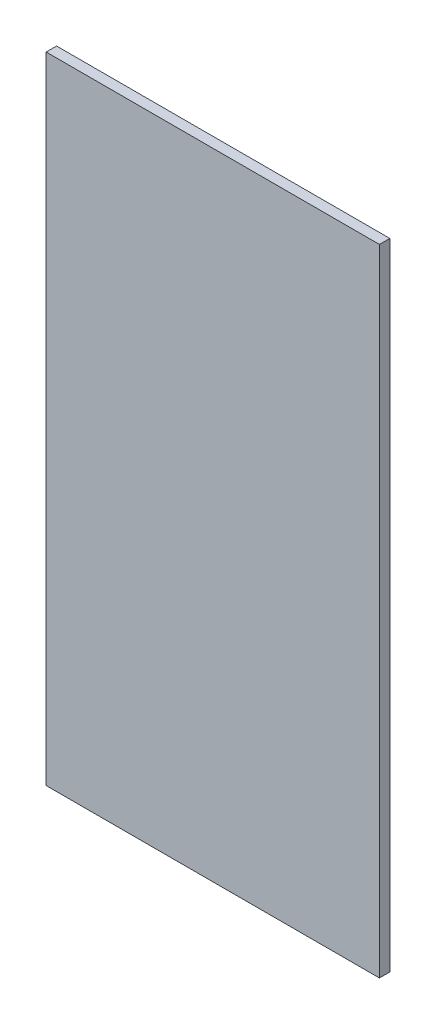
from build123d import *

# Parameters (mm, degrees)
SKETCH1_W           = 203.2
SKETCH1_H           = 387.35
BOSS_EXTRUDE1_DEPTH = 6.35


with BuildPart() as part:
    # Sketch1 → Boss-Extrude1 (new body)
    with BuildSketch(Plane.XY):
        with Locations((38.447665056, 88.148429952)):
            Rectangle(SKETCH1_W, SKETCH1_H)
    extrude(amount=BOSS_EXTRUDE1_DEPTH)


solid = part.part
